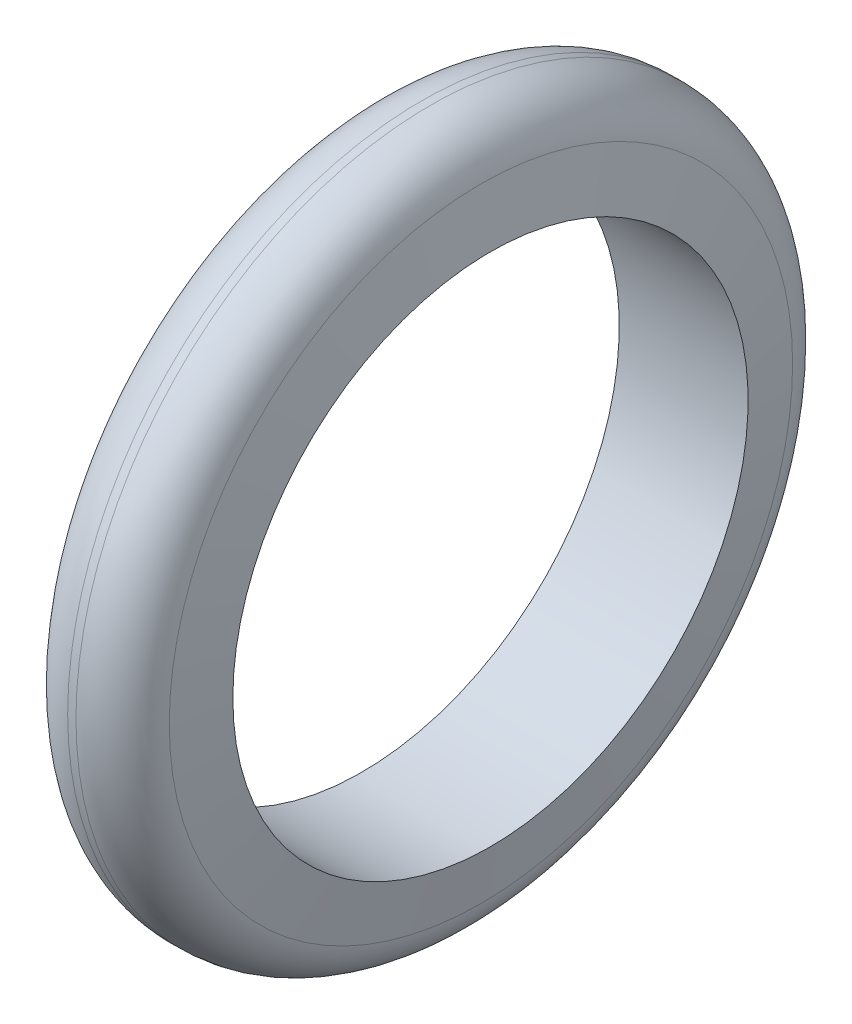
from build123d import *

# Parameters (mm, degrees)
FILLET1_R = 8
FILLET2_R = 8


with BuildPart() as part:
    # Sketch1 → Revolve1 (revolve)
    with BuildSketch(Plane.XY, mode=Mode.PRIVATE) as revolve1_sk:
        Polygon((-7.355095289, 55), (7.355095289, 55), (10, 40), (-10, 40), align=None)
    revolve(revolve1_sk.sketch.rotate(Axis((0, 0, 0), (1, 0, 0)), 90), axis=Axis((0, 0, 0), (1, 0, 0)))

    # Fillet1
    fillet1_edges = [part.edges().sort_by_distance(p)[0] for p in [
        (7.355095289, 0, -55),
    ]]
    fillet(fillet1_edges, radius=FILLET1_R)

    # Fillet2
    fillet2_edges = [part.edges().sort_by_distance(p)[0] for p in [
        (-7.355095289, 0, -55),
    ]]
    fillet(fillet2_edges, radius=FILLET2_R)


solid = part.part
